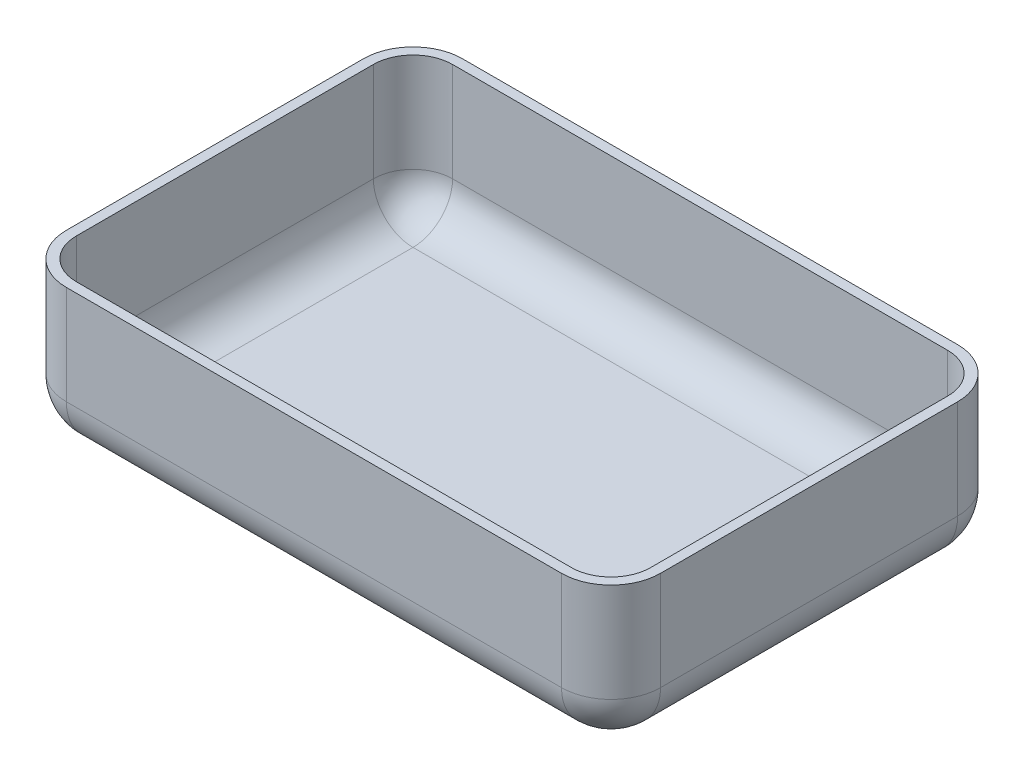
from build123d import *

# Parameters (mm, degrees)
CROQUIS1_W              = 152.4
CROQUIS1_H              = 101.6
SALIENTE_EXTRUIR1_DEPTH = 38.1
REDONDEO1_R             = 12.7
VACIADO1_T              = -2.54


with BuildPart() as part:
    # Croquis1 → Saliente-Extruir1 (new body)
    with BuildSketch(Plane(origin=(0, 0, 0), x_dir=(1, 0, 0), z_dir=(0, 1, 0))):
        Rectangle(CROQUIS1_W, CROQUIS1_H)
    extrude(amount=SALIENTE_EXTRUIR1_DEPTH)

    # Redondeo1
    redondeo1_edges = [part.edges().sort_by_distance(p)[0] for p in [
        (0, 0, -50.8),
        (76.2, 0, 0),
        (0, 0, 50.8),
        (-76.2, 0, 0),
        (-76.2, 19.05, -50.8),
        (76.2, 19.05, -50.8),
        (76.2, 19.05, 50.8),
        (-76.2, 19.05, 50.8),
    ]]
    fillet(redondeo1_edges, radius=REDONDEO1_R)

    # Vaciado1
    vaciado1_openings = [part.faces().sort_by_distance(p)[0] for p in [
        (0, 38.1, 0),
    ]]
    offset(amount=VACIADO1_T, openings=vaciado1_openings, kind=Kind.INTERSECTION)


solid = part.part
